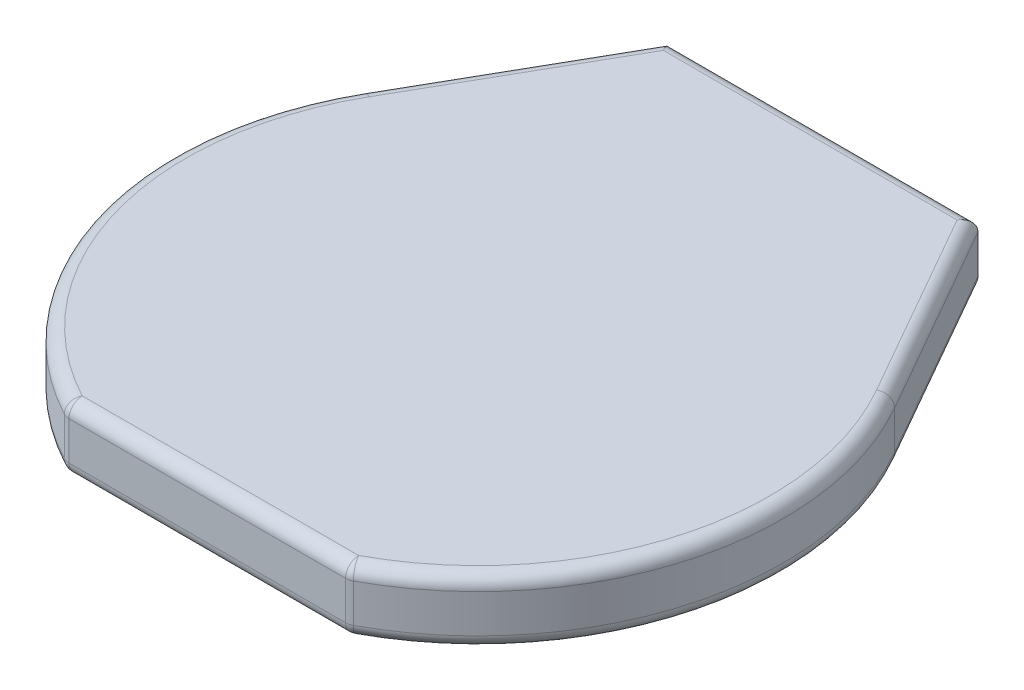
from build123d import *

# Parameters (mm, degrees)
BOSS_EXTRUDE1_DEPTH = 3.68
FILLET1_R           = 0.75


with BuildPart() as part:
    # Sketch1 → Boss-Extrude1 (new body)
    with BuildSketch(Plane(origin=(0, 0, 0), x_dir=(1, 0, 0), z_dir=(0, 1, 0))):
        with BuildLine():
            Line((-8.04, -15.374683737), (8.04, -15.374683737))
            ThreePointArc((8.04, -15.374683737), (16.648631389, -4.883192899), (15.070836501, 8.596068122))
            Line((15.070836501, 8.596068122), (8.78, 19.625316263))
            Line((8.78, 19.625316263), (-8.78, 19.625316263))
            Line((-8.78, 19.625316263), (-15.070836501, 8.596068122))
            ThreePointArc((-15.070836501, 8.596068122), (-16.648631389, -4.883192899), (-8.04, -15.374683737))
        make_face()
    extrude(amount=BOSS_EXTRUDE1_DEPTH)

    # Fillet1
    fillet1_edges = [part.edges().sort_by_distance(p)[0] for p in [
        (8.04, 1.84, 15.374683737),
        (-8.04, 1.84, 15.374683737),
        (16.648631389, 3.68, 4.883192899),
        (11.92541825, 3.68, -14.110692193),
        (0, 3.68, -19.625316263),
        (-11.92541825, 3.68, -14.110692193),
        (-16.648631389, 3.68, 4.883192899),
        (-11.92541825, 0, -14.110692193),
        (0, 0, -19.625316263),
        (11.92541825, 0, -14.110692193),
        (16.648631389, 0, 4.883192899),
        (0, 0, 15.374683737),
        (-16.648631389, 0, 4.883192899),
        (0, 3.68, 15.374683737),
    ]]
    fillet(fillet1_edges, radius=FILLET1_R)


solid = part.part
